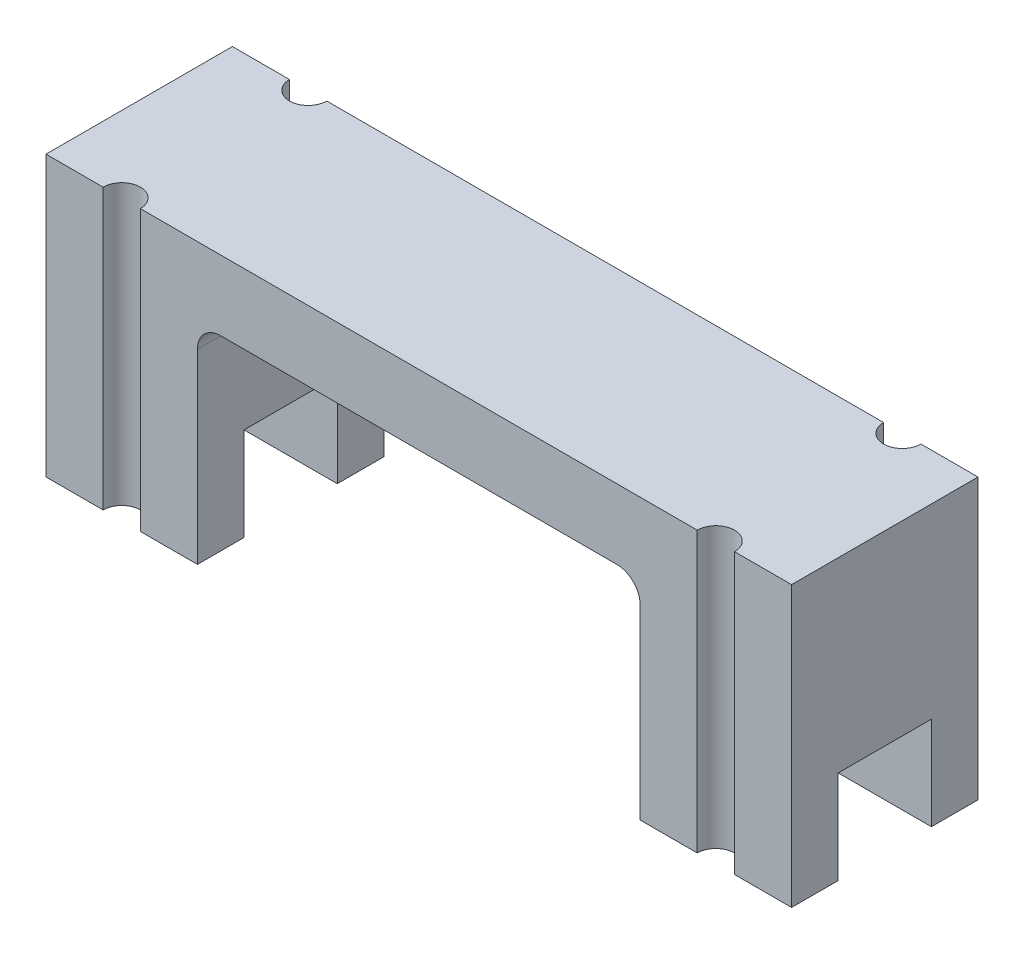
from build123d import *

# Parameters (mm, degrees)
SKETCH_1_W               = 160
SKETCH_1_H               = 60
EXTRUDE_1_DEPTH          = 30
SKETCH_2_W               = 20
SKETCH_2_H               = 40
CUT_EXTRUDE_1_DEPTH      = 171
SKETCH_3_W               = 95
SKETCH_3_H               = 90
CUT_EXTRUDE_2_DEPTH      = 171
FILLET_1_R               = 5
EXTRUDE_2_DEPTH          = 5
EXTRUDE_START            = 5
EXTRUDE_3_DEPTH          = 5
CUT_EXTRUDE_3_DEPTH      = 91
CUT_EXTRUDE_3_DEPTH_BACK = 33
SKETCH_6_R               = 4


with BuildPart() as part:
    # 草图1 → 凸台-拉伸1 (new body)
    with BuildSketch(Plane.XY):
        Rectangle(SKETCH_1_W, SKETCH_1_H)
    extrude(amount=EXTRUDE_1_DEPTH)

    # 草图2 → 切除-拉伸1 (cut)
    with BuildSketch(Plane.ZY.offset(80)):
        with Locations((15, -30)):
            Rectangle(SKETCH_2_W, SKETCH_2_H)
    extrude(amount=-CUT_EXTRUDE_1_DEPTH, mode=Mode.SUBTRACT)

    # 草图3 → 切除-拉伸2 (cut)
    with BuildSketch(Plane.XY.offset(30)):
        with Locations((0, -30)):
            Rectangle(SKETCH_3_W, SKETCH_3_H)
    extrude(amount=-CUT_EXTRUDE_2_DEPTH, mode=Mode.SUBTRACT)

    # 圆角1
    fillet_1_edges = [part.edges().sort_by_distance(p)[0] for p in [
        (-47.5, 15, 15),
        (47.5, 15, 15),
    ]]
    fillet(fillet_1_edges, radius=FILLET_1_R)

    # 草图4 → 凸台-拉伸2 (add)
    with BuildSketch(Plane.XY.offset(30)):
        with BuildLine():
            Line((-47.5, -30), (-47.5, 10))
            ThreePointArc((-47.5, 10), (-46.035533906, 13.535533906), (-42.5, 15))
            Line((-42.5, 15), (42.5, 15))
            ThreePointArc((42.5, 15), (46.035533906, 13.535533906), (47.5, 10))
            Line((47.5, 10), (47.5, -30))
            Line((47.5, -30), (80, -30))
            Line((80, -30), (80, 30))
            Line((80, 30), (-80, 30))
            Line((-80, 30), (-80, -30))
            Line((-80, -30), (-47.5, -30))
        make_face()
    extrude(amount=EXTRUDE_2_DEPTH)

    # 草图5 → 凸台-拉伸3 (add)
    with BuildSketch(Plane(origin=(0, 0, 0), x_dir=(-1, 0, 0), z_dir=(0, 0, -1)).offset(EXTRUDE_START)):
        with BuildLine():
            Line((-47.5, -30), (-47.5, 10))
            ThreePointArc((-47.5, 10), (-46.035533906, 13.535533906), (-42.5, 15))
            Line((-42.5, 15), (42.5, 15))
            ThreePointArc((42.5, 15), (46.035533906, 13.535533906), (47.5, 10))
            Line((47.5, 10), (47.5, -30))
            Line((47.5, -30), (80, -30))
            Line((80, -30), (80, 30))
            Line((80, 30), (-80, 30))
            Line((-80, 30), (-80, -30))
            Line((-80, -30), (-47.5, -30))
        make_face()
    extrude(amount=-EXTRUDE_3_DEPTH)

    # 草图6 → 切除-拉伸3 (cut, two sides: drawn at the far end of the back side and taken through both)
    with BuildSketch(Plane.XZ.offset(-15).offset(-CUT_EXTRUDE_3_DEPTH_BACK)):
        with Locations((-63.75, 35)):
            Circle(SKETCH_6_R)
        with Locations((-63.75, -5)):
            Circle(SKETCH_6_R)
        with Locations((63.75, -5)):
            Circle(SKETCH_6_R)
        with Locations((63.75, 35)):
            Circle(SKETCH_6_R)
    extrude(amount=CUT_EXTRUDE_3_DEPTH + CUT_EXTRUDE_3_DEPTH_BACK, mode=Mode.SUBTRACT)


solid = part.part
